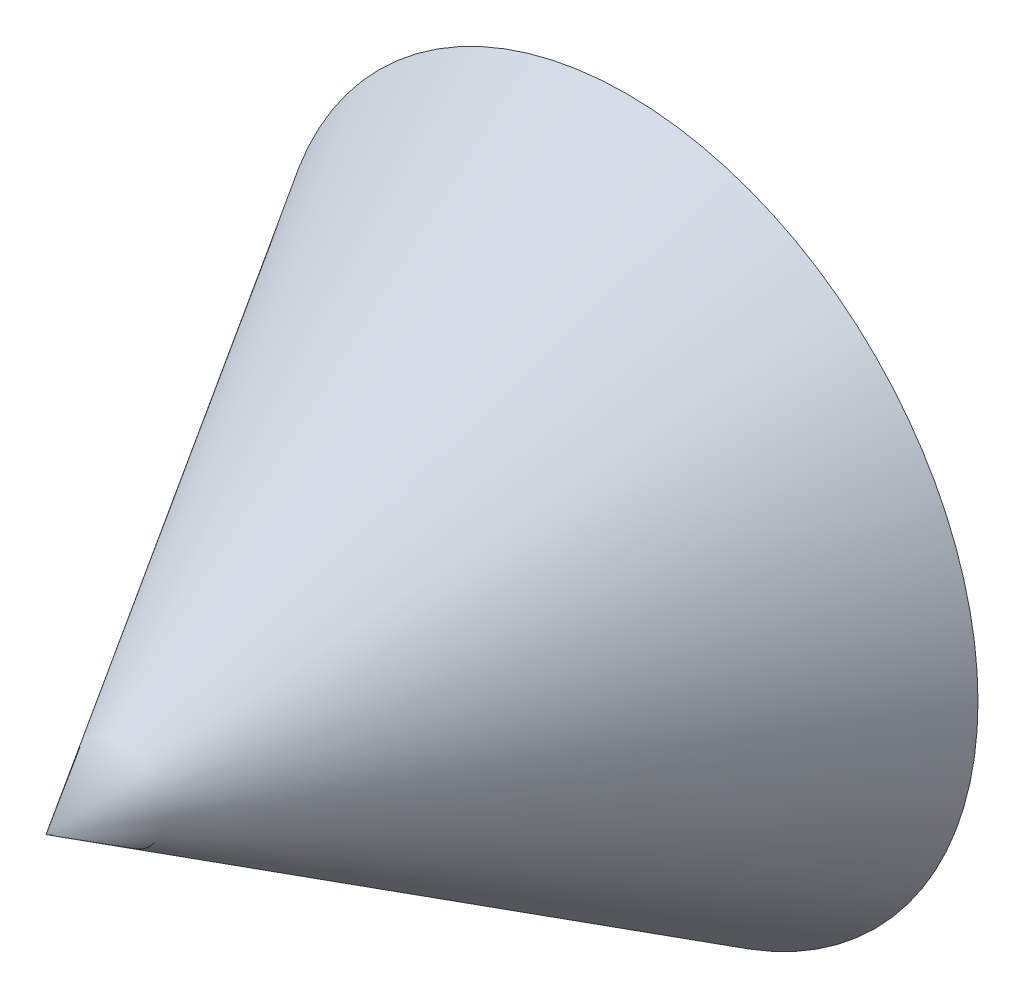
from build123d import *


with BuildPart() as part:
    # Sketch1 → Revolve2 (revolve)
    with BuildSketch(Plane(origin=(0, 0, 0), x_dir=(1, 0, 0), z_dir=(0, 1, 0)), mode=Mode.PRIVATE) as revolve2_sk:
        Polygon((0, 0), (0, 200), (120.647713349, 200), align=None)
    revolve(revolve2_sk.sketch.rotate(Axis((0, 0, 0), (0, 0, -1)), 180), axis=Axis((0, 0, 0), (0, 0, -1)))


solid = part.part
